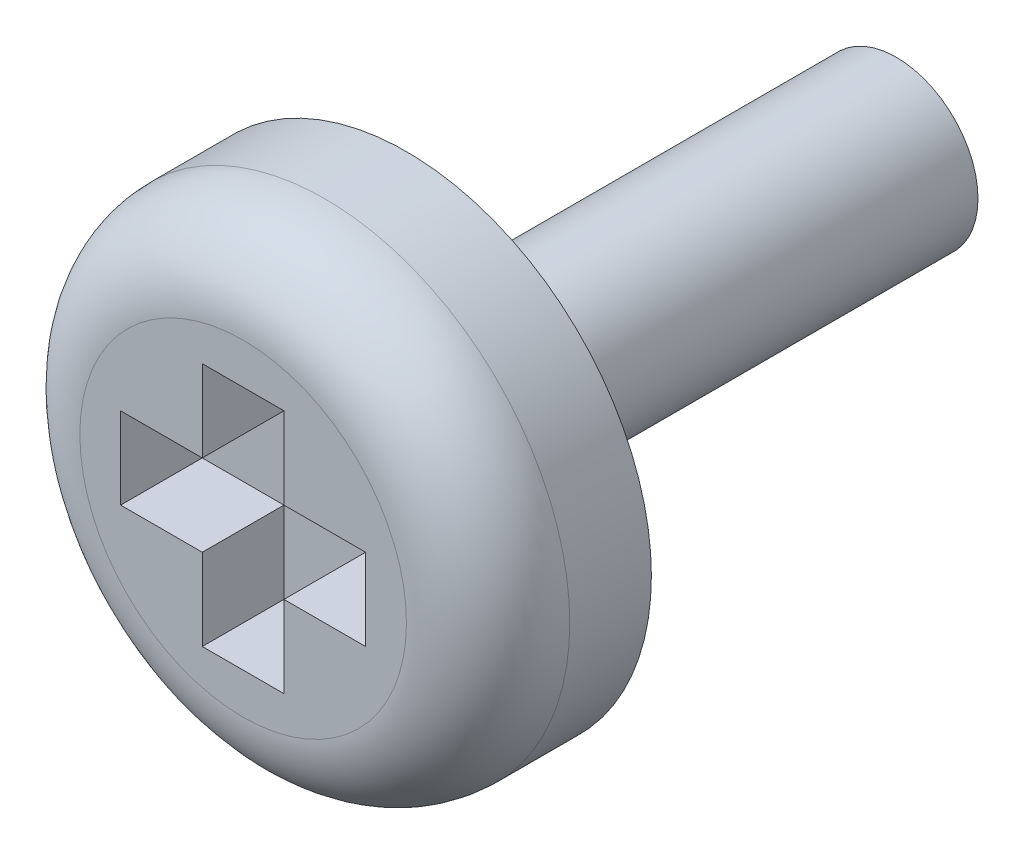
from build123d import *

# Parameters (mm, degrees)
SKETCH_1_R          = 0.5
EXTRUDE_1_DEPTH     = 3
SKETCH_2_R          = 1.5
EXTRUDE_2_DEPTH     = 1
FILLET_1_R          = 0.5
CUT_EXTRUDE_1_DEPTH = 0.5


with BuildPart() as part:
    # 草图1 → 凸台-拉伸1 (new body)
    with BuildSketch(Plane.XY):
        Circle(SKETCH_1_R)
    extrude(amount=EXTRUDE_1_DEPTH)

    # 草图2 → 凸台-拉伸2 (add)
    with BuildSketch(Plane.XY.offset(3)):
        Circle(SKETCH_2_R)
    extrude(amount=EXTRUDE_2_DEPTH)

    # 圆角1
    fillet_1_edges = [part.edges().sort_by_distance(p)[0] for p in [
        (-1.5, 0, 4),
    ]]
    fillet(fillet_1_edges, radius=FILLET_1_R)

    # 草图3 → 切除-拉伸1 (cut)
    with BuildSketch(Plane.XY.offset(4)):
        Polygon((-0.75, 0.25), (-0.25, 0.25), (-0.25, 0.75), (0.25, 0.75), (0.25, 0.25), (0.75, 0.25), (0.75, -0.25), (0.25, -0.25), (0.25, -0.75), (-0.25, -0.75), (-0.25, -0.25), (-0.75, -0.25), align=None)
    extrude(amount=-CUT_EXTRUDE_1_DEPTH, mode=Mode.SUBTRACT)


solid = part.part
